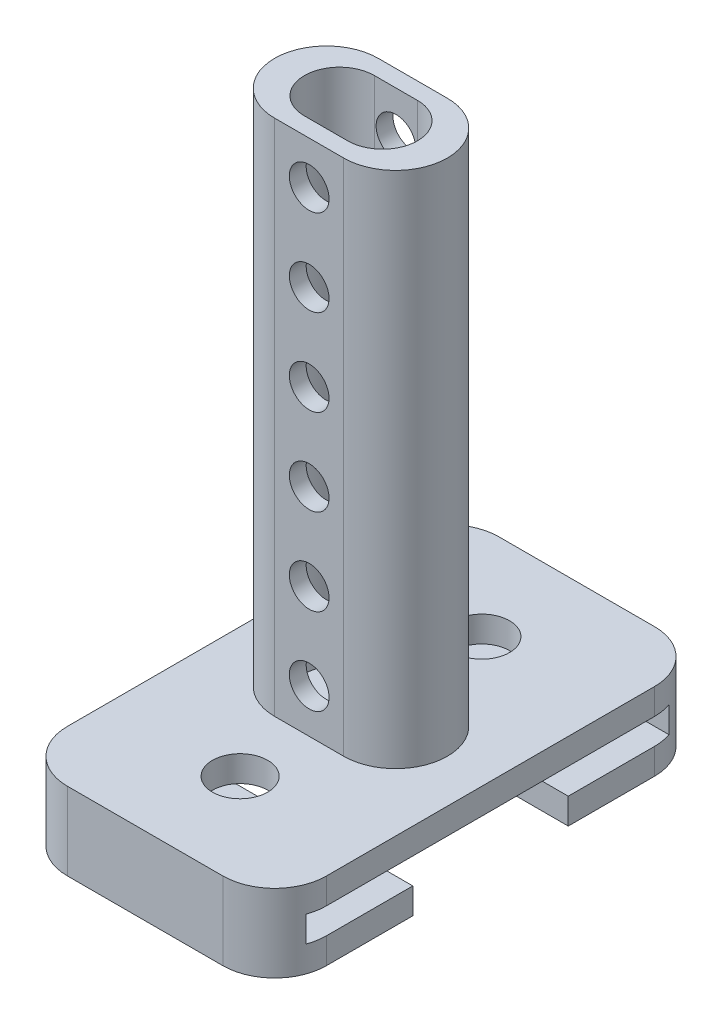
from build123d import *

# Parameters (mm, degrees)
EXTRUDE_1_DEPTH     = 60
SKETCH_3_R          = 2.3
CUT_EXTRUDE_1_DEPTH = 30
SKETCH_4_W          = 30
SKETCH_4_H          = 50
EXTRUDE_2_DEPTH     = 3
EXTRUDE_3_DEPTH     = 15
SKETCH_6_W          = 47.657493386
SKETCH_6_H          = 61.593201797
CUT_EXTRUDE_2_DEPTH = 30
SKETCH_7_R          = 3.2
CUT_EXTRUDE_3_DEPTH = 3


with BuildPart() as part:
    # 草图2 → 凸台-拉伸1 (new body)
    with BuildSketch(Plane(origin=(0, 0, 0), x_dir=(1, 0, 0), z_dir=(0, 1, 0))):
        with BuildLine():
            Line((-4, 6), (4, 6))
            ThreePointArc((4, 6), (10, 0), (4, -6))
            Line((4, -6), (-4, -6))
            ThreePointArc((-4, -6), (-10, 0), (-4, 6))
        make_face()
        with BuildLine():
            Line((-2.5, 4.05), (2.5, 4.05))
            ThreePointArc((2.5, 4.05), (6.55, 0), (2.5, -4.05))
            Line((2.5, -4.05), (-2.5, -4.05))
            ThreePointArc((-2.5, -4.05), (-6.55, 0), (-2.5, 4.05))
        make_face(mode=Mode.SUBTRACT)
    extrude(amount=EXTRUDE_1_DEPTH)

    # 草图3 → 切除-拉伸1 (cut)
    with BuildSketch(Plane.XY.offset(6)):
        with Locations((0, 55.049214592)):
            Circle(SKETCH_3_R)
        with Locations((0, 45.049214592)):
            Circle(SKETCH_3_R)
        with Locations((0, 35.049214592)):
            Circle(SKETCH_3_R)
        with Locations((0, 25.049214592)):
            Circle(SKETCH_3_R)
        with Locations((0, 15.049214592)):
            Circle(SKETCH_3_R)
        with Locations((0, 5.049214592)):
            Circle(SKETCH_3_R)
    extrude(amount=-CUT_EXTRUDE_1_DEPTH, mode=Mode.SUBTRACT)

    # 草图4 → 凸台-拉伸2 (add)
    with BuildSketch(Plane.XZ):
        Rectangle(SKETCH_4_W, SKETCH_4_H)
    extrude(amount=EXTRUDE_2_DEPTH)

    # 草图5 → 凸台-拉伸3 (add, symmetric)
    with BuildSketch(Plane(origin=(0, 0, 0), x_dir=(0, 0, -1), z_dir=(1, 0, 0))):
        Polygon((-25, -3), (-21, -3), (-21, -6), (-9, -6), (-9, -9), (-25, -9), (-25, -6), align=None)
        Polygon((25, -3), (21, -3), (21, -6), (9, -6), (9, -9), (25, -9), (25, -6), align=None)
    extrude(amount=EXTRUDE_3_DEPTH, both=True)

    # 草图6 → 切除-拉伸2 (cut)
    with BuildSketch(Plane(origin=(0, 0, 0), x_dir=(1, 0, 0), z_dir=(0, 1, 0))):
        with Locations((1.592624165, 0.101186893)):
            Rectangle(SKETCH_6_W, SKETCH_6_H)
        with BuildLine():
            Line((15, -19), (15, 19))
            ThreePointArc((15, 19), (13.242640687, 23.242640687), (9, 25))
            Line((9, 25), (-9, 25))
            ThreePointArc((-9, 25), (-13.242640687, 23.242640687), (-15, 19))
            Line((-15, 19), (-15, -19))
            ThreePointArc((-15, -19), (-13.242640687, -23.242640687), (-9, -25))
            Line((-9, -25), (9, -25))
            ThreePointArc((9, -25), (13.242640687, -23.242640687), (15, -19))
        make_face(mode=Mode.SUBTRACT)
    extrude(amount=-CUT_EXTRUDE_2_DEPTH, mode=Mode.SUBTRACT)

    # 草图7 → 切除-拉伸3 (cut)
    with BuildSketch(Plane(origin=(0, 0, 0), x_dir=(1, 0, 0), z_dir=(0, 1, 0))):
        with Locations(Location((0, 14, 0), (0, 0, 270))):
            Circle(SKETCH_7_R)
        with Locations(Location((0, -14, 0), (0, 0, 90))):
            Circle(SKETCH_7_R)
    extrude(amount=-CUT_EXTRUDE_3_DEPTH, mode=Mode.SUBTRACT)


solid = part.part
